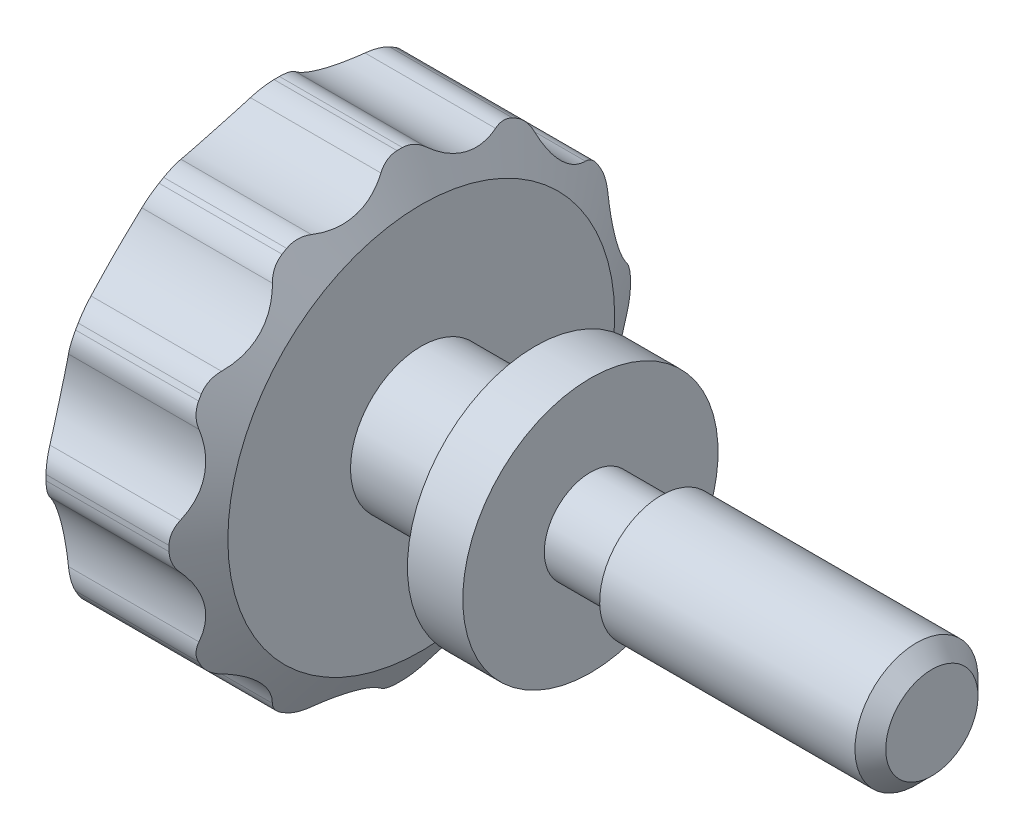
from build123d import *

# Parameters (mm, degrees)
CHAMFER_1_SIZE      = 0.5
CUT_EXTRUDE_1_DEPTH = 3.4
CUT_EXTRUDE_2_REACH = 26.423
FILLET_1_R          = 1


with BuildPart() as part:
    # Sketch 1 → Повернуть1 (revolve)
    with BuildSketch(Plane.XY):
        Polygon((-21.3, 7.5), (-17.3, 7.5), (-16.6, 6.287564435), (-16.6, 2.3), (-12.9, 2.3), (-12.9, 4.15), (-11.1, 4.15), (-11.1, 1.5), (-8.8, 1.5), (-8.8, 2), (0, 2), (0, 0), (-20.2, 0), (-20.2, 1.7), (-21, 1.914359354), (-22, 5.5), (-22, 6.287564435), align=None)
    revolve(axis=Axis((0, 0, 0), (-1, 0, 0)))

    # Фаска1
    chamfer_1_edges = [part.edges().sort_by_distance(p)[0] for p in [
        (0, -2, 0),
    ]]
    chamfer(chamfer_1_edges, length=CHAMFER_1_SIZE)

    # Эскиз2 → Вырез-Вытянуть1 (cut)
    with BuildSketch(Plane.ZY.offset(22)):
        with BuildLine():
            Line((-0.52, 5.301330022), (-0.52, 3.27171209))
            ThreePointArc((-0.52, 3.27171209), (-0.564120215, 3.146406493), (-0.677014925, 3.076385995))
            ThreePointArc((-0.677014925, 3.076385995), (-1.575, 2.727980022), (-2.325720961, 2.124505122))
            ThreePointArc((-2.325720961, 2.124505122), (-2.442807847, 2.061745683), (-2.573385784, 2.086189255))
            Line((-2.573385784, 2.086189255), (-4.331086473, 3.100998221))
            ThreePointArc((-4.331086473, 3.100998221), (-4.427322898, 3.235586394), (-4.38925793, 3.396603425))
            ThreePointArc((-4.38925793, 3.396603425), (-2.775, 4.806440991), (-0.746915888, 5.499510583))
            ThreePointArc((-0.746915888, 5.499510583), (-0.588438565, 5.451967297), (-0.52, 5.301330022))
        make_face()
        with BuildLine():
            Line((4.331086473, 3.100998221), (2.573385784, 2.086189255))
            ThreePointArc((2.573385784, 2.086189255), (2.442807847, 2.061745683), (2.325720961, 2.124505122))
            ThreePointArc((2.325720961, 2.124505122), (1.575, 2.727980022), (0.677014925, 3.076385995))
            ThreePointArc((0.677014925, 3.076385995), (0.564120215, 3.146406493), (0.52, 3.27171209))
            Line((0.52, 3.27171209), (0.52, 5.301330022))
            ThreePointArc((0.52, 5.301330022), (0.588438565, 5.451967297), (0.746915888, 5.499510583))
            ThreePointArc((0.746915888, 5.499510583), (2.775, 4.806440991), (4.38925793, 3.396603425))
            ThreePointArc((4.38925793, 3.396603425), (4.427322898, 3.235586394), (4.331086473, 3.100998221))
        make_face()
        with BuildLine():
            Line((4.851086473, -2.200331801), (3.093385784, -1.185522835))
            ThreePointArc((3.093385784, -1.185522835), (3.006928061, -1.08466081), (3.002735886, -0.951880873))
            ThreePointArc((3.002735886, -0.951880873), (3.15, 0), (3.002735886, 0.951880873))
            ThreePointArc((3.002735886, 0.951880873), (3.006928061, 1.08466081), (3.093385784, 1.185522835))
            Line((3.093385784, 1.185522835), (4.851086473, 2.200331801))
            ThreePointArc((4.851086473, 2.200331801), (5.015761463, 2.216380903), (5.136173817, 2.102907158))
            ThreePointArc((5.136173817, 2.102907158), (5.55, 0), (5.136173817, -2.102907158))
            ThreePointArc((5.136173817, -2.102907158), (5.015761463, -2.216380903), (4.851086473, -2.200331801))
        make_face()
        with BuildLine():
            Line((0.52, -5.301330022), (0.52, -3.27171209))
            ThreePointArc((0.52, -3.27171209), (0.564120215, -3.146406493), (0.677014925, -3.076385995))
            ThreePointArc((0.677014925, -3.076385995), (1.575, -2.727980022), (2.325720961, -2.124505122))
            ThreePointArc((2.325720961, -2.124505122), (2.442807847, -2.061745683), (2.573385784, -2.086189255))
            Line((2.573385784, -2.086189255), (4.331086473, -3.100998221))
            ThreePointArc((4.331086473, -3.100998221), (4.427322898, -3.235586394), (4.38925793, -3.396603425))
            ThreePointArc((4.38925793, -3.396603425), (2.775, -4.806440991), (0.746915888, -5.499510583))
            ThreePointArc((0.746915888, -5.499510583), (0.588438565, -5.451967297), (0.52, -5.301330022))
        make_face()
        with BuildLine():
            Line((-4.331086473, -3.100998221), (-2.573385784, -2.086189255))
            ThreePointArc((-2.573385784, -2.086189255), (-2.442807847, -2.061745683), (-2.325720961, -2.124505122))
            ThreePointArc((-2.325720961, -2.124505122), (-1.575, -2.727980022), (-0.677014925, -3.076385995))
            ThreePointArc((-0.677014925, -3.076385995), (-0.564120215, -3.146406493), (-0.52, -3.27171209))
            Line((-0.52, -3.27171209), (-0.52, -5.301330022))
            ThreePointArc((-0.52, -5.301330022), (-0.588438565, -5.451967297), (-0.746915888, -5.499510583))
            ThreePointArc((-0.746915888, -5.499510583), (-2.775, -4.806440991), (-4.38925793, -3.396603425))
            ThreePointArc((-4.38925793, -3.396603425), (-4.427322898, -3.235586394), (-4.331086473, -3.100998221))
        make_face()
        with BuildLine():
            Line((-4.851086473, 2.200331801), (-3.093385784, 1.185522835))
            ThreePointArc((-3.093385784, 1.185522835), (-3.006928061, 1.08466081), (-3.002735886, 0.951880873))
            ThreePointArc((-3.002735886, 0.951880873), (-3.15, 0), (-3.002735886, -0.951880873))
            ThreePointArc((-3.002735886, -0.951880873), (-3.006928061, -1.08466081), (-3.093385784, -1.185522835))
            Line((-3.093385784, -1.185522835), (-4.851086473, -2.200331801))
            ThreePointArc((-4.851086473, -2.200331801), (-5.015761463, -2.216380903), (-5.136173817, -2.102907158))
            ThreePointArc((-5.136173817, -2.102907158), (-5.55, 0), (-5.136173817, 2.102907158))
            ThreePointArc((-5.136173817, 2.102907158), (-5.015761463, 2.216380903), (-4.851086473, 2.200331801))
        make_face()
    extrude(amount=-CUT_EXTRUDE_1_DEPTH, mode=Mode.SUBTRACT)

    # Вырез-Вытянуть2: up to this cone (the profile starts inside it)
    cut_extrude_2_end = Plane(origin=(-22, 0, 0), z_dir=(-1, 0, 0)).offset(-9.030126019) * Cone(1.732e-06, 89.363023745, 51.593764814, align=(Align.CENTER, Align.CENTER, Align.MIN), mode=Mode.PRIVATE)
    # Эскиз3 → Вырез-Вытянуть2 (cut, up to the surface)
    with BuildSketch(Plane.ZY.offset(22), mode=Mode.PRIVATE) as cut_extrude_2_sk1:
        with BuildLine():
            ThreePointArc((-0.5, 7.483314774), (-1.792321887, 6.689036347), (-3.308644685, 6.730740698))
            ThreePointArc((-3.308644685, 6.730740698), (-1.941142838, 7.244443697), (-0.5, 7.483314774))
        make_face()
    cut_extrude_2_tool1 = extrude(cut_extrude_2_sk1.sketch, amount=-CUT_EXTRUDE_2_REACH, mode=Mode.PRIVATE) & cut_extrude_2_end
    add(cut_extrude_2_tool1.solids().sort_by_distance((-22, 6.993248, -1.873835))[0], mode=Mode.SUBTRACT)
    # Эскиз3 → Вырез-Вытянуть2 (cut, up to the surface)
    with BuildSketch(Plane.ZY.offset(22), mode=Mode.PRIVATE) as cut_extrude_2_sk2:
        with BuildLine():
            ThreePointArc((3.308644685, 6.730740698), (1.792321887, 6.689036347), (0.5, 7.483314774))
            ThreePointArc((0.5, 7.483314774), (1.941142838, 7.244443697), (3.308644685, 6.730740698))
        make_face()
    cut_extrude_2_tool2 = extrude(cut_extrude_2_sk2.sketch, amount=-CUT_EXTRUDE_2_REACH, mode=Mode.PRIVATE) & cut_extrude_2_end
    add(cut_extrude_2_tool2.solids().sort_by_distance((-22, 6.993248, 1.873835))[0], mode=Mode.SUBTRACT)
    # Эскиз3 → Вырез-Вытянуть2 (cut, up to the surface)
    with BuildSketch(Plane.ZY.offset(22), mode=Mode.PRIVATE) as cut_extrude_2_sk3:
        with BuildLine():
            ThreePointArc((6.230740698, 4.174670089), (4.89671446, 4.89671446), (4.174670089, 6.230740698))
            ThreePointArc((4.174670089, 6.230740698), (5.303300859, 5.303300859), (6.230740698, 4.174670089))
        make_face()
    cut_extrude_2_tool3 = extrude(cut_extrude_2_sk3.sketch, amount=-CUT_EXTRUDE_2_REACH, mode=Mode.PRIVATE) & cut_extrude_2_end
    add(cut_extrude_2_tool3.solids().sort_by_distance((-22, 5.119413, 5.119413))[0], mode=Mode.SUBTRACT)
    # Эскиз3 → Вырез-Вытянуть2 (cut, up to the surface)
    with BuildSketch(Plane.ZY.offset(22), mode=Mode.PRIVATE) as cut_extrude_2_sk4:
        with BuildLine():
            ThreePointArc((7.483314774, 0.5), (6.689036347, 1.792321887), (6.730740698, 3.308644685))
            ThreePointArc((6.730740698, 3.308644685), (7.244443697, 1.941142838), (7.483314774, 0.5))
        make_face()
    cut_extrude_2_tool4 = extrude(cut_extrude_2_sk4.sketch, amount=-CUT_EXTRUDE_2_REACH, mode=Mode.PRIVATE) & cut_extrude_2_end
    add(cut_extrude_2_tool4.solids().sort_by_distance((-22, 1.873835, 6.993248))[0], mode=Mode.SUBTRACT)
    # Эскиз3 → Вырез-Вытянуть2 (cut, up to the surface)
    with BuildSketch(Plane.ZY.offset(22), mode=Mode.PRIVATE) as cut_extrude_2_sk5:
        with BuildLine():
            ThreePointArc((6.730740698, -3.308644685), (6.689036347, -1.792321887), (7.483314774, -0.5))
            ThreePointArc((7.483314774, -0.5), (7.244443697, -1.941142838), (6.730740698, -3.308644685))
        make_face()
    cut_extrude_2_tool5 = extrude(cut_extrude_2_sk5.sketch, amount=-CUT_EXTRUDE_2_REACH, mode=Mode.PRIVATE) & cut_extrude_2_end
    add(cut_extrude_2_tool5.solids().sort_by_distance((-22, -1.873835, 6.993248))[0], mode=Mode.SUBTRACT)
    # Эскиз3 → Вырез-Вытянуть2 (cut, up to the surface)
    with BuildSketch(Plane.ZY.offset(22), mode=Mode.PRIVATE) as cut_extrude_2_sk6:
        with BuildLine():
            ThreePointArc((4.174670089, -6.230740698), (4.89671446, -4.89671446), (6.230740698, -4.174670089))
            ThreePointArc((6.230740698, -4.174670089), (5.303300859, -5.303300859), (4.174670089, -6.230740698))
        make_face()
    cut_extrude_2_tool6 = extrude(cut_extrude_2_sk6.sketch, amount=-CUT_EXTRUDE_2_REACH, mode=Mode.PRIVATE) & cut_extrude_2_end
    add(cut_extrude_2_tool6.solids().sort_by_distance((-22, -5.119413, 5.119413))[0], mode=Mode.SUBTRACT)
    # Эскиз3 → Вырез-Вытянуть2 (cut, up to the surface)
    with BuildSketch(Plane.ZY.offset(22), mode=Mode.PRIVATE) as cut_extrude_2_sk7:
        with BuildLine():
            ThreePointArc((0.5, -7.483314774), (1.792321887, -6.689036347), (3.308644685, -6.730740698))
            ThreePointArc((3.308644685, -6.730740698), (1.941142838, -7.244443697), (0.5, -7.483314774))
        make_face()
    cut_extrude_2_tool7 = extrude(cut_extrude_2_sk7.sketch, amount=-CUT_EXTRUDE_2_REACH, mode=Mode.PRIVATE) & cut_extrude_2_end
    add(cut_extrude_2_tool7.solids().sort_by_distance((-22, -6.993248, 1.873835))[0], mode=Mode.SUBTRACT)
    # Эскиз3 → Вырез-Вытянуть2 (cut, up to the surface)
    with BuildSketch(Plane.ZY.offset(22), mode=Mode.PRIVATE) as cut_extrude_2_sk8:
        with BuildLine():
            ThreePointArc((-3.308644685, -6.730740698), (-1.792321887, -6.689036347), (-0.5, -7.483314774))
            ThreePointArc((-0.5, -7.483314774), (-1.941142838, -7.244443697), (-3.308644685, -6.730740698))
        make_face()
    cut_extrude_2_tool8 = extrude(cut_extrude_2_sk8.sketch, amount=-CUT_EXTRUDE_2_REACH, mode=Mode.PRIVATE) & cut_extrude_2_end
    add(cut_extrude_2_tool8.solids().sort_by_distance((-22, -6.993248, -1.873835))[0], mode=Mode.SUBTRACT)
    # Эскиз3 → Вырез-Вытянуть2 (cut, up to the surface)
    with BuildSketch(Plane.ZY.offset(22), mode=Mode.PRIVATE) as cut_extrude_2_sk9:
        with BuildLine():
            ThreePointArc((-6.230740698, -4.174670089), (-4.89671446, -4.89671446), (-4.174670089, -6.230740698))
            ThreePointArc((-4.174670089, -6.230740698), (-5.303300859, -5.303300859), (-6.230740698, -4.174670089))
        make_face()
    cut_extrude_2_tool9 = extrude(cut_extrude_2_sk9.sketch, amount=-CUT_EXTRUDE_2_REACH, mode=Mode.PRIVATE) & cut_extrude_2_end
    add(cut_extrude_2_tool9.solids().sort_by_distance((-22, -5.119413, -5.119413))[0], mode=Mode.SUBTRACT)
    # Эскиз3 → Вырез-Вытянуть2 (cut, up to the surface)
    with BuildSketch(Plane.ZY.offset(22), mode=Mode.PRIVATE) as cut_extrude_2_sk10:
        with BuildLine():
            ThreePointArc((-7.483314774, -0.5), (-6.689036347, -1.792321887), (-6.730740698, -3.308644685))
            ThreePointArc((-6.730740698, -3.308644685), (-7.244443697, -1.941142838), (-7.483314774, -0.5))
        make_face()
    cut_extrude_2_tool10 = extrude(cut_extrude_2_sk10.sketch, amount=-CUT_EXTRUDE_2_REACH, mode=Mode.PRIVATE) & cut_extrude_2_end
    add(cut_extrude_2_tool10.solids().sort_by_distance((-22, -1.873835, -6.993248))[0], mode=Mode.SUBTRACT)
    # Эскиз3 → Вырез-Вытянуть2 (cut, up to the surface)
    with BuildSketch(Plane.ZY.offset(22), mode=Mode.PRIVATE) as cut_extrude_2_sk11:
        with BuildLine():
            ThreePointArc((-6.730740698, 3.308644685), (-6.689036347, 1.792321887), (-7.483314774, 0.5))
            ThreePointArc((-7.483314774, 0.5), (-7.244443697, 1.941142838), (-6.730740698, 3.308644685))
        make_face()
    cut_extrude_2_tool11 = extrude(cut_extrude_2_sk11.sketch, amount=-CUT_EXTRUDE_2_REACH, mode=Mode.PRIVATE) & cut_extrude_2_end
    add(cut_extrude_2_tool11.solids().sort_by_distance((-22, 1.873835, -6.993248))[0], mode=Mode.SUBTRACT)
    # Эскиз3 → Вырез-Вытянуть2 (cut, up to the surface)
    with BuildSketch(Plane.ZY.offset(22), mode=Mode.PRIVATE) as cut_extrude_2_sk12:
        with BuildLine():
            ThreePointArc((-4.174670089, 6.230740698), (-4.89671446, 4.89671446), (-6.230740698, 4.174670089))
            ThreePointArc((-6.230740698, 4.174670089), (-5.303300859, 5.303300859), (-4.174670089, 6.230740698))
        make_face()
    cut_extrude_2_tool12 = extrude(cut_extrude_2_sk12.sketch, amount=-CUT_EXTRUDE_2_REACH, mode=Mode.PRIVATE) & cut_extrude_2_end
    add(cut_extrude_2_tool12.solids().sort_by_distance((-22, 5.119413, -5.119413))[0], mode=Mode.SUBTRACT)

    # Скругление1
    fillet_1_edges = [part.edges().sort_by_distance(p)[0] for p in [
        (-19.3, 7.483314774, 0.5),
        (-19.3, 6.730740698, 3.308644685),
        (-19.3, 6.230740698, 4.174670089),
        (-19.3, 4.174670089, 6.230740698),
        (-19.3, 3.308644685, 6.730740698),
        (-19.3, 0.5, 7.483314774),
        (-19.3, -0.5, 7.483314774),
        (-19.3, -3.308644685, 6.730740698),
        (-19.3, -4.174670089, 6.230740698),
        (-19.3, -6.230740698, 4.174670089),
        (-19.3, -6.730740698, 3.308644685),
        (-19.3, -7.483314774, 0.5),
        (-19.3, -7.483314774, -0.5),
        (-19.3, -6.730740698, -3.308644685),
        (-19.3, -6.230740698, -4.174670089),
        (-19.3, -4.174670089, -6.230740698),
        (-19.3, -3.308644685, -6.730740698),
        (-19.3, -0.5, -7.483314774),
        (-19.3, 0.5, -7.483314774),
        (-19.3, 3.308644685, -6.730740698),
        (-19.3, 4.174670089, -6.230740698),
        (-19.3, 6.230740698, -4.174670089),
        (-19.3, 6.730740698, -3.308644685),
        (-19.3, 7.483314774, -0.5),
    ]]
    fillet(fillet_1_edges, radius=FILLET_1_R)


solid = part.part
